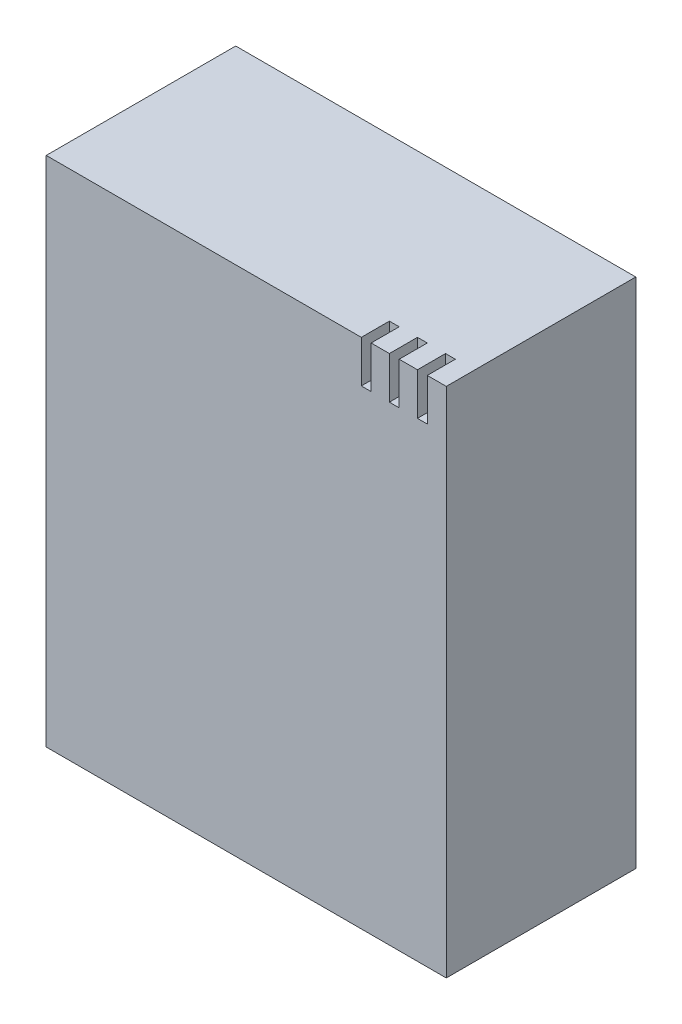
from build123d import *

# Parameters (mm, degrees)
SKETCH1_W           = 28.5
SKETCH1_H           = 13.5
BOSS_EXTRUDE1_DEPTH = 36.5
SKETCH2_W           = 0.7
SKETCH2_H           = 2
CUT_EXTRUDE1_DEPTH  = 3


with BuildPart() as part:
    # Sketch1 → Boss-Extrude1 (new body)
    with BuildSketch(Plane(origin=(0, 0, 0), x_dir=(1, 0, 0), z_dir=(0, 1, 0))):
        Rectangle(SKETCH1_W, SKETCH1_H)
    extrude(amount=BOSS_EXTRUDE1_DEPTH)

    # Sketch2 → Cut-Extrude1 (cut)
    with BuildSketch(Plane(origin=(0, 36.5, 0), x_dir=(1, 0, 0), z_dir=(0, 1, 0))):
        with Locations((12.546248595, -5.75)):
            Rectangle(SKETCH2_W, SKETCH2_H)
        with Locations((10.546248595, -5.75)):
            Rectangle(SKETCH2_W, SKETCH2_H)
        with Locations((8.546248595, -5.75)):
            Rectangle(SKETCH2_W, SKETCH2_H)
    extrude(amount=-CUT_EXTRUDE1_DEPTH, mode=Mode.SUBTRACT)


solid = part.part
